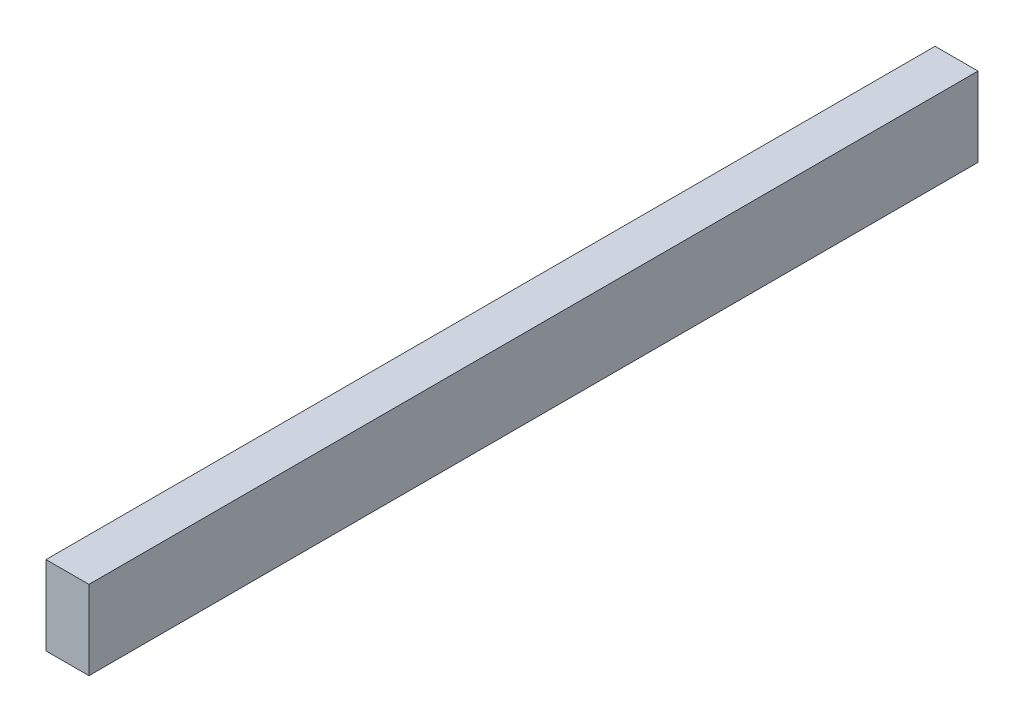
from build123d import *

# Parameters (mm, degrees)
SKETCH1_W           = 72.5
SKETCH1_H           = 6.45280161
BOSS_EXTRUDE1_DEPTH = 3.5


with BuildPart() as part:
    # Sketch1 → Boss-Extrude1 (new body)
    with BuildSketch(Plane(origin=(0, 0, 0), x_dir=(0, 0, -1), z_dir=(1, 0, 0))):
        with Locations((12.502432277, 3.226400805)):
            Rectangle(SKETCH1_W, SKETCH1_H)
    extrude(amount=BOSS_EXTRUDE1_DEPTH)


solid = part.part
